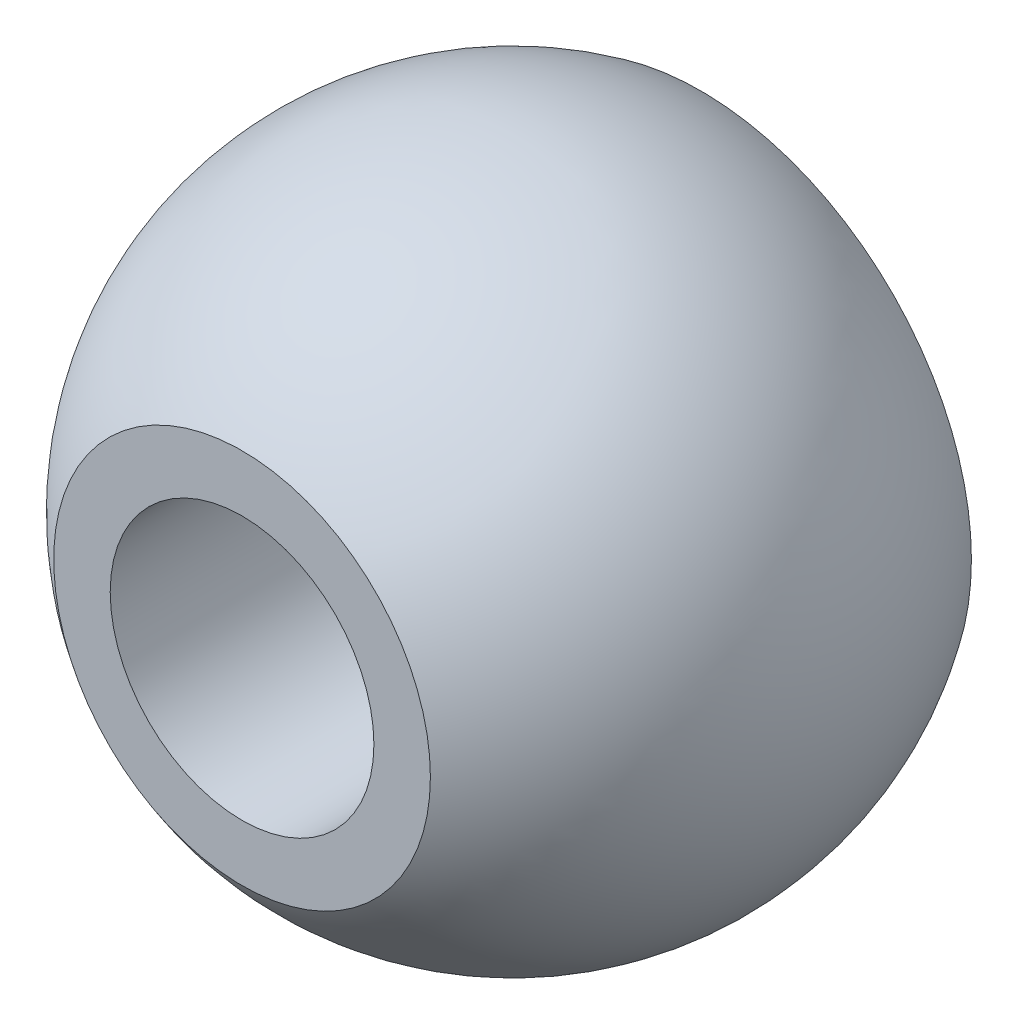
from build123d import *


with BuildPart() as part:
    # Sketch1 → Revolve1 (revolve)
    with BuildSketch(Plane(origin=(0, 0, 0), x_dir=(1, 0, 0), z_dir=(0, 1, 0))):
        with BuildLine():
            Line((88.308421985, 0), (86.1, 0))
            Line((86.1, 0), (86.1, -7.308421985))
            Line((86.1, -7.308421985), (87, -7.308421985))
            ThreePointArc((87, -7.308421985), (89.167834745, -3.925194058), (88.308421985, 0))
        make_face()
    revolve(axis=Axis((84, 0, 0), (0, 0, 1)))


solid = part.part
